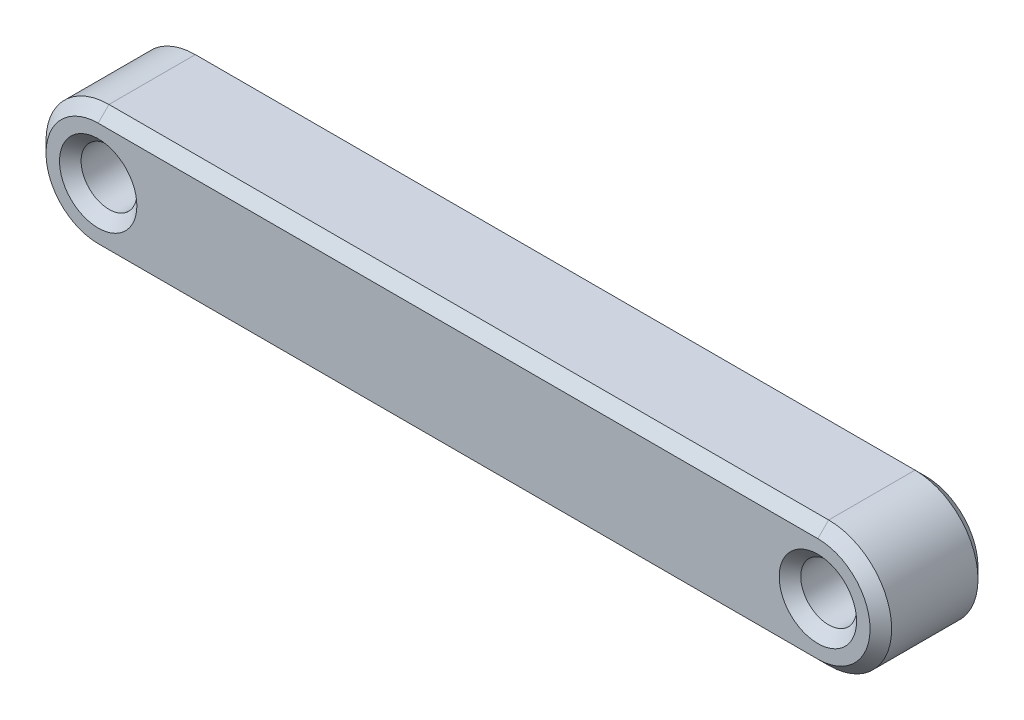
from build123d import *

# Parameters (mm, degrees)
SKETCH_1_R      = 1.55
EXTRUDE_1_DEPTH = 6
CHAMFER_1_SIZE  = 0.6


with BuildPart() as part:
    # 草图1 → 凸台-拉伸1 (new body)
    with BuildSketch(Plane.XY):
        with BuildLine():
            ThreePointArc((0, 3.5), (-3.5, 0), (0, -3.5))
            Line((0, -3.5), (40, -3.5))
            ThreePointArc((40, -3.5), (43.5, 0), (40, 3.5))
            Line((40, 3.5), (0, 3.5))
        make_face()
        Circle(SKETCH_1_R, mode=Mode.SUBTRACT)
        with Locations((40, 0)):
            Circle(SKETCH_1_R, mode=Mode.SUBTRACT)
    extrude(amount=EXTRUDE_1_DEPTH)

    # 倒角1
    chamfer_1_edges = [part.edges().sort_by_distance(p)[0] for p in [
        (43.5, 0, 6),
        (20, 3.5, 6),
        (-3.5, 0, 6),
        (38.45, 0, 6),
        (-1.55, 0, 6),
        (20, -3.5, 6),
        (-1.55, 0, 0),
        (38.45, 0, 0),
        (-3.5, 0, 0),
        (20, 3.5, 0),
        (43.5, 0, 0),
        (20, -3.5, 0),
    ]]
    chamfer(chamfer_1_edges, length=CHAMFER_1_SIZE)


solid = part.part
